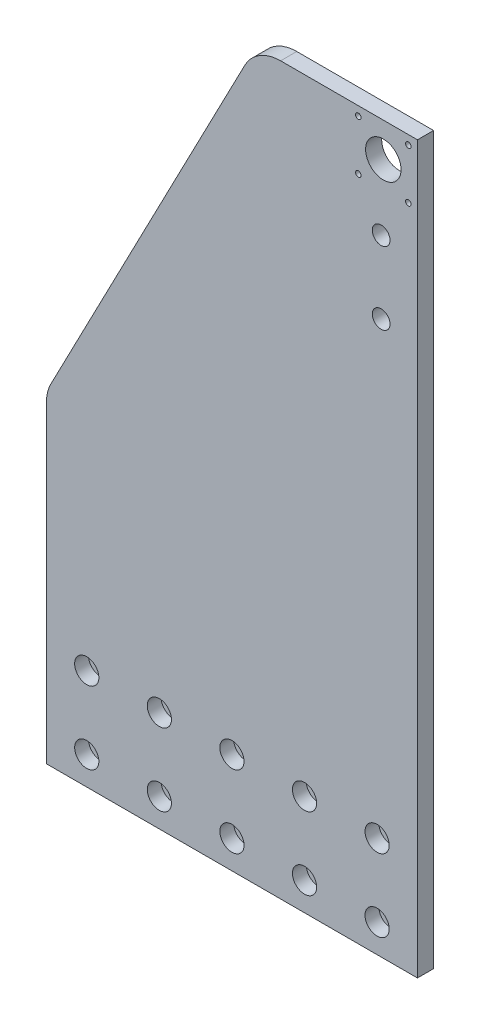
from build123d import *

# Parameters (mm, degrees)
BOSS_EXTRUDE1_DEPTH                                 = 5
CBORE_FOR_M8_HEX_SOCKET_HEAD_CAP_SCREW1_D           = 9
CBORE_FOR_M8_HEX_SOCKET_HEAD_CAP_SCREW1_CBORE_D     = 15
CBORE_FOR_M8_HEX_SOCKET_HEAD_CAP_SCREW1_CBORE_DEPTH = 8.6
SKETCH5_R                                           = 11
CUT_EXTRUDE2_DEPTH                                  = 465.569693372
CBORE_FOR_M3_HEX_SOCKET_HEAD_CAP_SCREW1_D           = 3.4
CBORE_FOR_M3_HEX_SOCKET_HEAD_CAP_SCREW1_CBORE_D     = 6.5
CBORE_FOR_M3_HEX_SOCKET_HEAD_CAP_SCREW1_CBORE_DEPTH = 3.4
FILLET1_R                                           = 25
M10_CLEARANCE_HOLE1_D                               = 11
M10_CLEARANCE_HOLE1_DEPTH                           = 25
M10_CLEARANCE_HOLE1_TIP                             = 3.304733405


with BuildPart() as part:
    # Sketch1 → Boss-Extrude1 (new, symmetric)
    with BuildSketch(Plane.XY):
        Polygon((-115, 200), (-115, 0), (115, 0), (115, 450), (15, 450), align=None)
    extrude(amount=BOSS_EXTRUDE1_DEPTH, both=True)

    # CBORE for M8 Hex Socket Head Cap Screw1 (through all)
    with Locations(Plane.XY.offset(5)):
        with Locations((-90, 17.5), (-45, 17.5), (45, 17.5), (90, 17.5), (0, 17.5), (-90, 62.5), (-45, 62.5), (45, 62.5), (90, 62.5), (0, 62.5)):
            CounterBoreHole(CBORE_FOR_M8_HEX_SOCKET_HEAD_CAP_SCREW1_D / 2, CBORE_FOR_M8_HEX_SOCKET_HEAD_CAP_SCREW1_CBORE_D / 2, CBORE_FOR_M8_HEX_SOCKET_HEAD_CAP_SCREW1_CBORE_DEPTH)

    # Sketch5 → Cut-Extrude2 (cut, through all)
    with BuildSketch(Plane.XY.offset(5)):
        with Locations((93.85, 428.85)):
            Circle(SKETCH5_R)
    extrude(amount=-CUT_EXTRUDE2_DEPTH, mode=Mode.SUBTRACT)

    # CBORE for M3 Hex Socket Head Cap Screw1 (through all)
    with Locations(Plane(origin=(0, 0, -5), x_dir=(1, 0, 0), z_dir=(0, 0, -1))):
        with Locations((109.35, -444.35), (78.35, -444.35), (78.35, -413.35), (109.35, -413.35)):
            CounterBoreHole(CBORE_FOR_M3_HEX_SOCKET_HEAD_CAP_SCREW1_D / 2, CBORE_FOR_M3_HEX_SOCKET_HEAD_CAP_SCREW1_CBORE_D / 2, CBORE_FOR_M3_HEX_SOCKET_HEAD_CAP_SCREW1_CBORE_DEPTH)

    # Fillet1
    fillet1_edges = [part.edges().sort_by_distance(p)[0] for p in [
        (-115, 200, 0),
        (15, 450, 0),
    ]]
    fillet(fillet1_edges, radius=FILLET1_R)

    # M10 Clearance Hole1
    with Locations(Plane.XY.offset(5)):
        with Locations((92.5, 387.5), (92.5, 342.5)):
            Hole(M10_CLEARANCE_HOLE1_D / 2, depth=M10_CLEARANCE_HOLE1_DEPTH)
            with Locations((0, 0, -(M10_CLEARANCE_HOLE1_DEPTH + M10_CLEARANCE_HOLE1_TIP / 2))):  # 118° drill point
                Cone(0, M10_CLEARANCE_HOLE1_D / 2, M10_CLEARANCE_HOLE1_TIP, mode=Mode.SUBTRACT)


solid = part.part
